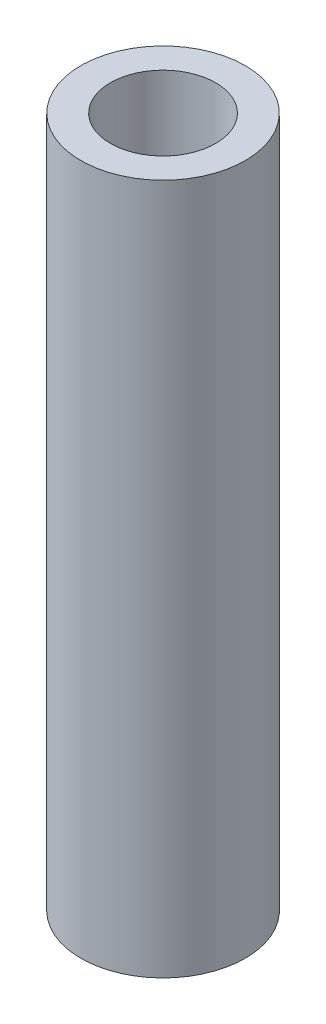
from build123d import *

# Parameters (mm, degrees)
SKETCH1_R            = 2.5
BOSS_EXTRUDE1_DEPTH  = 10.5
M3_CLEARANCE_HOLE1_D = 3.2


with BuildPart() as part:
    # Sketch1 → Boss-Extrude1 (new, symmetric)
    with BuildSketch(Plane(origin=(0, 0, 0), x_dir=(1, 0, 0), z_dir=(0, 1, 0))):
        with Locations(Location((0, 0, 0), (0, 0, 90))):
            Circle(SKETCH1_R)
    extrude(amount=BOSS_EXTRUDE1_DEPTH, both=True)

    # M3 Clearance Hole1 (through all)
    with Locations(Plane(origin=(0, 10.5, 0), x_dir=(1, 0, 0), z_dir=(0, 1, 0))):
        with Locations((0, 0)):
            Hole(M3_CLEARANCE_HOLE1_D / 2)


solid = part.part
